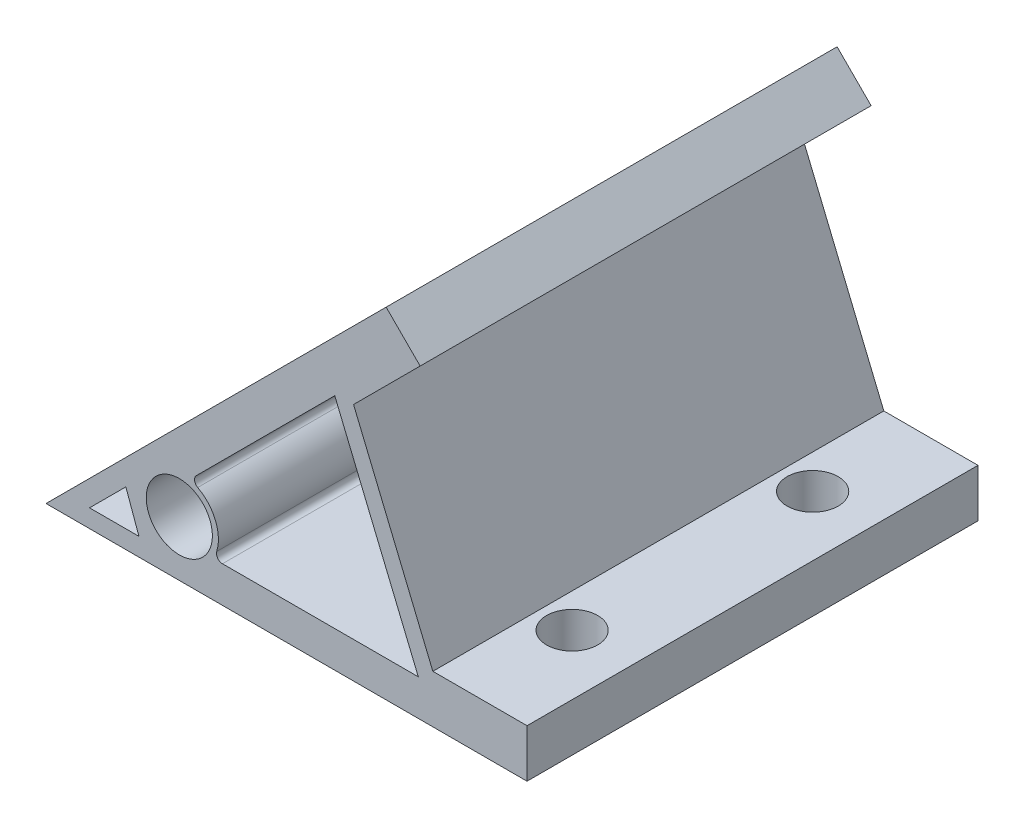
from build123d import *

# Parameters (mm, degrees)
SKETCH_1_R          = 5.5
EXTRUDE_1_DEPTH     = 37.5
SKETCH_2_R          = 4.25
CUT_EXTRUDE_1_DEPTH = 13
SKETCH_3_R          = 4.25
CUT_EXTRUDE_2_DEPTH = 101.822385015


with BuildPart() as part:
    # 草图1 → 凸台-拉伸1 (new, symmetric)
    with BuildSketch(Plane.XY):
        Polygon((0, 0), (80, 0), (80, 8), (64.335195596, 8), (51.148707324, 39.834998826), (62.225396744, 50.911688245), (56.568542495, 56.568542495), align=None)
        with Locations((22.17310878, 9.184402377)):
            Circle(SKETCH_1_R, mode=Mode.SUBTRACT)
        Polygon((7.242640687, 3), (15.457113006, 3), (13.279414953, 9.036774265), align=None, mode=Mode.SUBTRACT)
        with BuildLine():
            Line((29.347952769, 6), (61.91644612, 6))
            Line((61.91644612, 6), (48.024179606, 39.538898231))
            Line((48.024179606, 39.538898231), (24.994777104, 16.509495729))
            ThreePointArc((24.994777104, 16.509495729), (24.712781801, 15.655157608), (25.231380538, 14.919990739))
            ThreePointArc((25.231380538, 14.919990739), (28.178325742, 11.671844687), (28.391306903, 7.29125365))
            ThreePointArc((28.391306903, 7.29125365), (28.544443699, 6.404707488), (29.347952769, 6))
        make_face(mode=Mode.SUBTRACT)
    extrude(amount=EXTRUDE_1_DEPTH, both=True)

    # 草图2 → 切除-拉伸1 (cut)
    with BuildSketch(Plane(origin=(0, 0, 0), x_dir=(0, 0, 1), z_dir=(-0.7071067811865477, 0.7071067811865475, 0))):
        with Locations(Location((20, 70, 0), (0, 0, 270))):
            Circle(SKETCH_2_R)
        with Locations(Location((-20, 70, 0), (0, 0, 270))):
            Circle(SKETCH_2_R)
    extrude(amount=-CUT_EXTRUDE_1_DEPTH, mode=Mode.SUBTRACT)

    # 草图3 → 切除-拉伸2 (cut, through all)
    with BuildSketch(Plane(origin=(0, 8, 0), x_dir=(1, 0, 0), z_dir=(0, 1, 0))):
        with Locations(Location((70, -20, 0), (0, 0, 270))):
            Circle(SKETCH_3_R)
        with Locations(Location((70, 20, 0), (0, 0, 270))):
            Circle(SKETCH_3_R)
    extrude(amount=-CUT_EXTRUDE_2_DEPTH, mode=Mode.SUBTRACT)


solid = part.part
